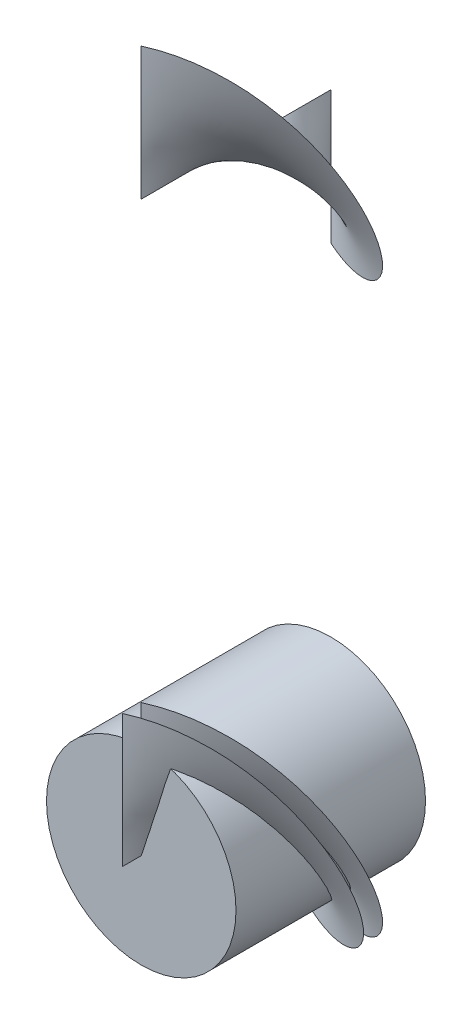
from build123d import *

# Parameters (mm, degrees)
SKETCH1_R           = 50
BOSS_EXTRUDE1_DEPTH = 100


with BuildPart() as part:
    # Sketch1 → Boss-Extrude1 (new body)
    with BuildSketch(Plane.XY):
        Circle(SKETCH1_R)
    extrude(amount=BOSS_EXTRUDE1_DEPTH)


solid = part.part
